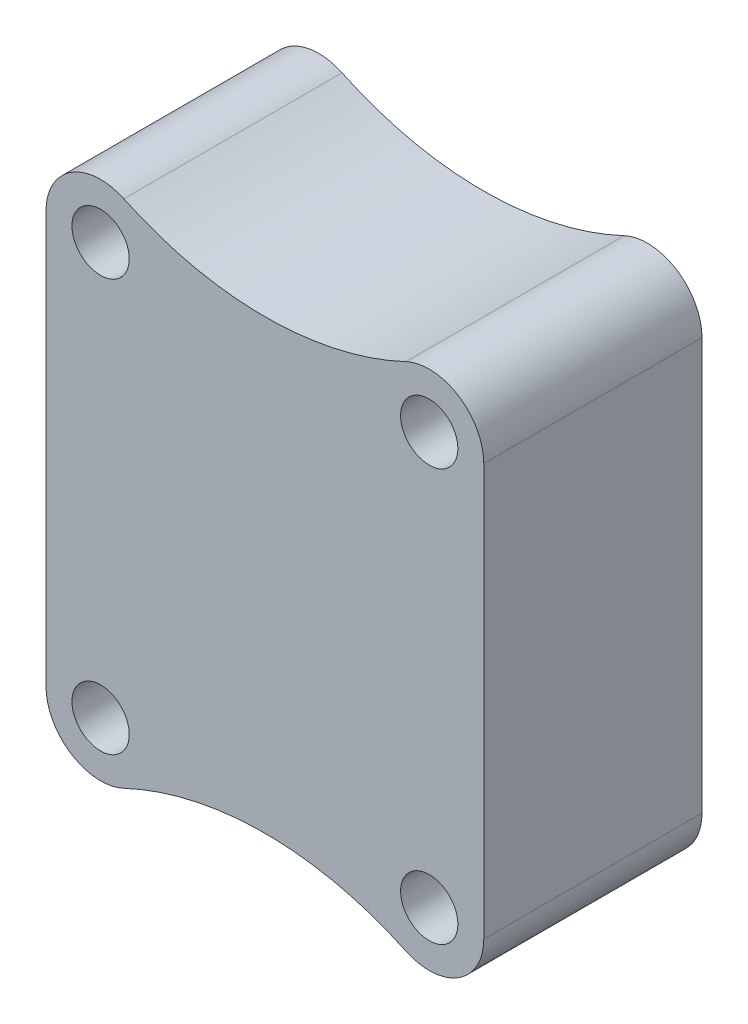
from build123d import *

# Parameters (mm, degrees)
SKETCH1_R           = 2.1
BOSS_EXTRUDE1_DEPTH = 16


with BuildPart() as part:
    # Sketch1 → Boss-Extrude1 (new body)
    with BuildSketch(Plane.XY):
        with BuildLine():
            Line((-4, 0), (-4, 30.2))
            ThreePointArc((-4, 30.2), (-2.141570433, 33.578413249), (1.706838041, 33.817554962))
            ThreePointArc((1.706838041, 33.817554962), (12.05, 31.5), (22.393161959, 33.817554962))
            ThreePointArc((22.393161959, 33.817554962), (26.241570433, 33.578413249), (28.1, 30.2))
            Line((28.1, 30.2), (28.1, 0))
            ThreePointArc((28.1, 0), (26.241570433, -3.378413249), (22.393161959, -3.617554962))
            ThreePointArc((22.393161959, -3.617554962), (12.05, -1.3), (1.706838041, -3.617554962))
            ThreePointArc((1.706838041, -3.617554962), (-2.141570433, -3.378413249), (-4, 0))
        make_face()
        Circle(SKETCH1_R, mode=Mode.SUBTRACT)
        with Locations((0, 30.2)):
            Circle(SKETCH1_R, mode=Mode.SUBTRACT)
        with Locations((24.1, 30.2)):
            Circle(SKETCH1_R, mode=Mode.SUBTRACT)
        with Locations((24.1, 0)):
            Circle(SKETCH1_R, mode=Mode.SUBTRACT)
    extrude(amount=BOSS_EXTRUDE1_DEPTH)


solid = part.part
